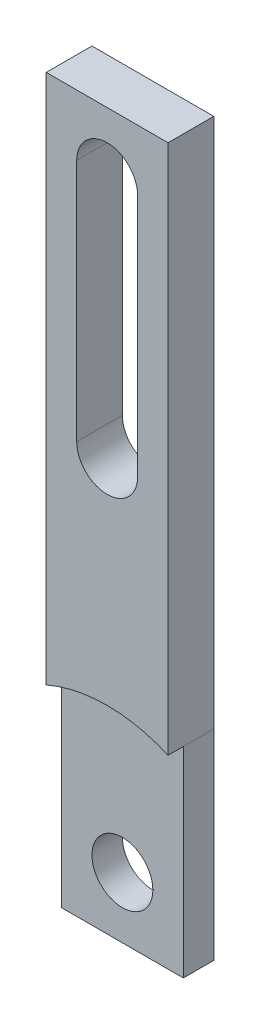
from build123d import *

# Parameters (mm, degrees)
RESSALTO_EXTRUS_O3_DEPTH      = 5
RESSALTO_EXTRUS_O3_DEPTH_BACK = 5
ESBO_O5_R                     = 10
RESSALTO_EXTRUS_O4_DEPTH      = 5
RESSALTO_EXTRUS_O4_DEPTH_BACK = 10


with BuildPart() as part:
    # Esboço5 → Ressalto-extrusão3 (new, two sides: drawn at the far end of the back side and taken through both)
    with BuildSketch(Plane.XY.offset(-RESSALTO_EXTRUS_O3_DEPTH_BACK)):
        with BuildLine():
            Line((-20, -86.701140479), (20, -86.701140479))
            Line((20, -86.701140479), (20, -20.87538353))
            ThreePointArc((20, -20.87538353), (0, -16.701140479), (-20, -20.87538353))
            Line((-20, -20.87538353), (-20, -86.701140479))
        make_face()
        with Locations((0, -66.701140479)):
            Circle(ESBO_O5_R, mode=Mode.SUBTRACT)
    extrude(amount=RESSALTO_EXTRUS_O3_DEPTH + RESSALTO_EXTRUS_O3_DEPTH_BACK)


with BuildPart() as body_2:
    # Esboço7 → Ressalto-extrusão4 (new, two sides: drawn at the far end of the back side and taken through both)
    with BuildSketch(Plane.XY.offset(5).offset(-RESSALTO_EXTRUS_O4_DEPTH_BACK)):
        with BuildLine():
            ThreePointArc((-20, -20.87538353), (0, -16.697321711), (20, -20.87538353))
            Line((20, -20.87538353), (20, 153.298859521))
            Line((20, 153.298859521), (0, 153.298859521))
            Line((0, 153.298859521), (-20, 153.298859521))
            Line((-20, 153.298859521), (-20, -20.87538353))
        make_face()
        with BuildLine():
            ThreePointArc((-10, 133.298859521), (-7.071067812, 140.369927333), (0, 143.298859521))
            ThreePointArc((0, 143.298859521), (7.071067812, 140.369927333), (10, 133.298859521))
            Line((10, 133.298859521), (10, 53.298859521))
            ThreePointArc((10, 53.298859521), (0, 43.298859521), (-10, 53.298859521))
            Line((-10, 53.298859521), (-10, 133.298859521))
        make_face(mode=Mode.SUBTRACT)
    extrude(amount=RESSALTO_EXTRUS_O4_DEPTH + RESSALTO_EXTRUS_O4_DEPTH_BACK)


solid = Compound([part.part, body_2.part])
